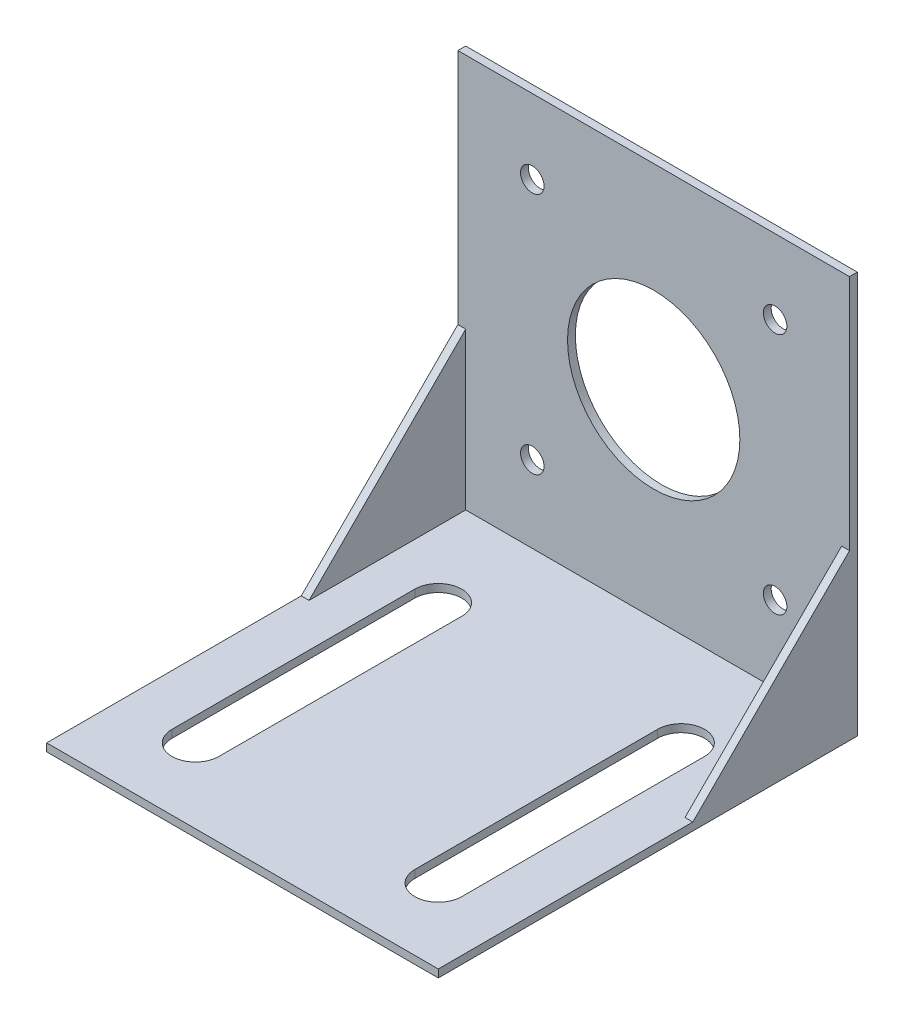
from build123d import *

# Parameters (mm, degrees)
SKETCH_1_W          = 50
SKETCH_1_H          = 53.5
EXTRUDE_1_DEPTH     = 1
SKETCH_2_W          = 50
SKETCH_2_H          = 51.3
SKETCH_2_R          = 1.5
EXTRUDE_2_DEPTH     = 1
EXTRUDE_3_DEPTH     = 1
EXTRUDE_4_DEPTH     = 1
SKETCH_7_R          = 11
CUT_EXTRUDE_1_DEPTH = 78.543149278


with BuildPart() as part:
    # 草图1 → 凸台-拉伸1 (new body)
    with BuildSketch(Plane(origin=(0, 0, 0), x_dir=(1, 0, 0), z_dir=(0, 1, 0))):
        Rectangle(SKETCH_1_W, SKETCH_1_H)
        with BuildLine():
            Line((-18.5, 13.75), (-18.5, -17.25))
            ThreePointArc((-18.5, -17.25), (-15.5, -20.25), (-12.5, -17.25))
            Line((-12.5, -17.25), (-12.5, 13.75))
            ThreePointArc((-12.5, 13.75), (-15.5, 16.75), (-18.5, 13.75))
        make_face(mode=Mode.SUBTRACT)
        with BuildLine():
            Line((12.5, 13.75), (12.5, -17.25))
            ThreePointArc((12.5, -17.25), (15.5, -20.25), (18.5, -17.25))
            Line((18.5, -17.25), (18.5, 13.75))
            ThreePointArc((18.5, 13.75), (15.5, 16.75), (12.5, 13.75))
        make_face(mode=Mode.SUBTRACT)
    extrude(amount=EXTRUDE_1_DEPTH)

    # 草图2 → 凸台-拉伸2 (add)
    with BuildSketch(Plane.XY.offset(-26.75)):
        with Locations((0, 25.65)):
            Rectangle(SKETCH_2_W, SKETCH_2_H)
        with Locations((-15.5, 41.8)):
            Circle(SKETCH_2_R, mode=Mode.SUBTRACT)
        with Locations((15.5, 41.8)):
            Circle(SKETCH_2_R, mode=Mode.SUBTRACT)
        with Locations((-15.5, 10.8)):
            Circle(SKETCH_2_R, mode=Mode.SUBTRACT)
        with Locations((15.5, 10.8)):
            Circle(SKETCH_2_R, mode=Mode.SUBTRACT)
    extrude(amount=EXTRUDE_2_DEPTH)

    # 草图4 → 凸台-拉伸3 (add)
    with BuildSketch(Plane(origin=(-25, 0, 0), x_dir=(0, 0, -1), z_dir=(1, 0, 0))):
        Polygon((25.75, 21), (5.75, 1), (25.75, 1), align=None)
    extrude(amount=EXTRUDE_3_DEPTH)

    # 草图6 → 凸台-拉伸4 (add)
    with BuildSketch(Plane.ZY.offset(-25)):
        Polygon((-25.75, 21), (-5.75, 1), (-25.75, 1), align=None)
    extrude(amount=EXTRUDE_4_DEPTH)

    # 草图7 → 切除-拉伸1 (cut, through all)
    with BuildSketch(Plane.XY.offset(-25.75)):
        with Locations((0, 26.3)):
            Circle(SKETCH_7_R)
    extrude(amount=-CUT_EXTRUDE_1_DEPTH, mode=Mode.SUBTRACT)


solid = part.part
